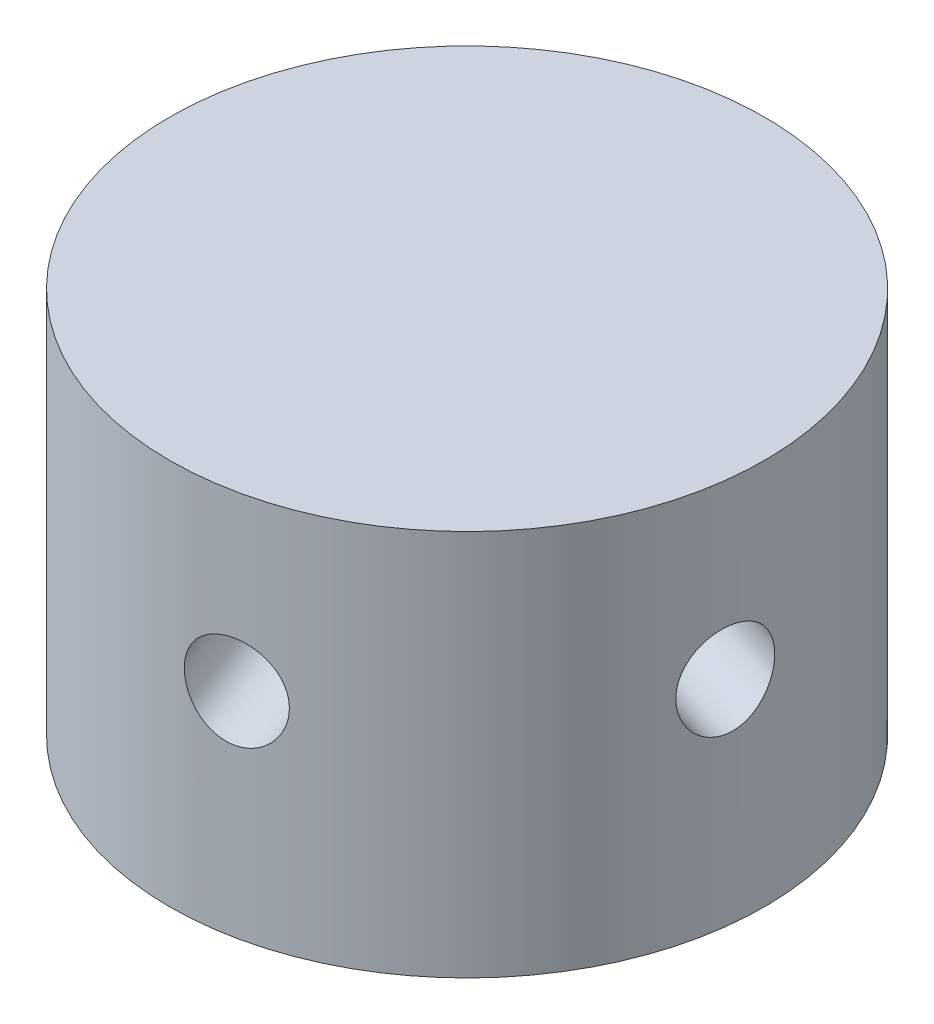
from build123d import *

# Parameters (mm, degrees)
BOSS_EXTRUDE1_DEPTH      = 3
BOSS_EXTRUDE1_DEPTH_BACK = 10
SKETCH1_R                = 10
SKETCH4_R                = 1.5
HOLE_DEPTH               = 20.973741561
HOLECIR_COUNT            = 5
SKETCH6_R                = 3.5
BEARINGHOLE_DEPTH        = 2.5
SKETCH7_R                = 2
SHAFTHOLE_DEPTH          = 17.248076982
SKETCH8_W                = 1.346153846
SKETCH8_H                = 0.358974359
SKETCH8_W_2              = 0.314102564
SKETCH8_H_2              = 2.557692308
BOSS_EXTRUDE3_DEPTH      = 1


with BuildPart() as part:
    # Sketch1 → Boss-Extrude1 (new, two sides: drawn at the far end of the back side and taken through both)
    with BuildSketch(Plane(origin=(0, 0, 0), x_dir=(1, 0, 0), z_dir=(0, 1, 0)).offset(-BOSS_EXTRUDE1_DEPTH_BACK)):
        Circle(SKETCH1_R)
    extrude(amount=BOSS_EXTRUDE1_DEPTH + BOSS_EXTRUDE1_DEPTH_BACK)

    # Sketch4 → hole (cut, through all)
    with BuildSketch(Plane(origin=(-3.352872105, -1.093066116, 1.887711608), x_dir=(-0.4486862613641547, -0.14627571033740308, -0.8816371449912632), z_dir=(0.8382180262940947, 0.2732665289126682, -0.47192790187872385))):
        Circle(SKETCH4_R)
    hole = extrude(amount=-HOLE_DEPTH, mode=Mode.SUBTRACT)

    # holecir: hole ×5 about axis
    holecir_axis = Axis((0, 5.5, 0), (0, -1, 0))
    for i in range(1, HOLECIR_COUNT):
        add(hole.rotate(holecir_axis, i * 360 / HOLECIR_COUNT), mode=Mode.SUBTRACT)

    # Sketch6 → bearinghole (cut)
    with BuildSketch(Plane(origin=(0, -5, 0), x_dir=(-1, 0, 0), z_dir=(0, -1, 0))):
        Circle(SKETCH6_R)
    extrude(amount=BEARINGHOLE_DEPTH, mode=Mode.SUBTRACT)

    # Sketch7 → shafthole (cut, through all)
    with BuildSketch(Plane(origin=(0, -5, 0), x_dir=(-1, 0, 0), z_dir=(0, -1, 0))):
        Circle(SKETCH7_R)
    extrude(amount=SHAFTHOLE_DEPTH, mode=Mode.SUBTRACT)

    # Sketch8 → Boss-Extrude3 (add)
    # profile 1 of 7: a face of its own
    with BuildSketch(Plane.XZ.offset(10)):
        with BuildLine():
            Line((-4.105769231, 6.129779464), (-4.105769231, 5.770805105))
            Line((-4.105769231, 5.770805105), (-5.296274038, 5.770805105))
            Line((-5.296274038, 5.770805105), (-5.484875801, 4.850232189))
            add(Edge.make_bspline(
                [(-5.484875801, 4.850232189), (-5.447819927, 4.860462461), (-5.376030031, 4.880281994), (-5.27007017, 4.902287765), (-5.169477967, 4.915553209), (-5.104202596, 4.917364519), (-5.072616186, 4.918241003)],
                knots=[0, 0, 0, 0, 1.100273476, 2.13160584, 3.095893838, 4, 4, 4, 4], degree=3))
            add(Edge.make_bspline(
                [(-5.072616186, 4.918241003), (-5.033532446, 4.917395067), (-4.956684049, 4.915731746), (-4.844245102, 4.899759897), (-4.736912209, 4.874619982), (-4.634909838, 4.83949946), (-4.538049288, 4.794589727), (-4.447221726, 4.738489787), (-4.361063813, 4.672956456), (-4.281121219, 4.597611444), (-4.208596911, 4.514689827), (-4.144830922, 4.425531956), (-4.090668331, 4.331004294), (-4.047107576, 4.230203685), (-4.012323242, 4.124244532), (-3.989171247, 4.012011949), (-3.973754538, 3.894563829), (-3.972032152, 3.814259259), (-3.971153846, 3.773309112)],
                knots=[0, 0, 0, 0, 1.052922333, 2.070308379, 3.05430497, 4.020497103, 4.973039431, 5.925935799, 6.892292201, 7.88610001, 8.88166317, 9.857072816, 10.836096531, 11.812156883, 12.81219415, 13.836441305, 14.89672472, 16, 16, 16, 16], degree=3))
            add(Edge.make_bspline(
                [(-3.971153846, 3.773309112), (-3.971818921, 3.744786892), (-3.973140084, 3.688127904), (-3.979858672, 3.603983703), (-3.992794388, 3.52162087), (-4.010162112, 3.441028478), (-4.03270453, 3.362359106), (-4.059993584, 3.285387578), (-4.093389611, 3.210592971), (-4.130020987, 3.137267576), (-4.171267465, 3.067069069), (-4.217045972, 3.001420083), (-4.265411463, 2.939335801), (-4.317452849, 2.881482068), (-4.373653844, 2.82823905), (-4.433333811, 2.779290769), (-4.49601653, 2.733809439), (-4.562671772, 2.693641243), (-4.631814255, 2.656678287), (-4.704442472, 2.62635475), (-4.778903172, 2.599244222), (-4.856268048, 2.577634694), (-4.936361861, 2.56070214), (-5.019316636, 2.549201539), (-5.104697306, 2.540825102), (-5.162572319, 2.540300745), (-5.191806891, 2.540035875)],
                knots=[0, 0, 0, 0, 1.056347294, 2.098418968, 3.122841568, 4.141288669, 5.149314143, 6.15115421, 7.162517403, 8.180376062, 9.185164535, 10.17417709, 11.141909838, 12.097768115, 13.052685741, 14.0056014, 14.954263652, 15.917497458, 16.885230207, 17.854509472, 18.828990115, 19.81800267, 20.826176721, 21.857883937, 22.917946725, 24, 24, 24, 24], degree=3))
            add(Edge.make_bspline(
                [(-5.191806891, 2.540035875), (-5.226681072, 2.540726713), (-5.295291902, 2.542085855), (-5.39581247, 2.55630434), (-5.492527075, 2.576668256), (-5.584657176, 2.607304526), (-5.67302844, 2.645691821), (-5.756451158, 2.694207992), (-5.837056934, 2.749187096), (-5.911568971, 2.814067449), (-5.980725084, 2.884983131), (-6.042631593, 2.961940772), (-6.09776517, 3.043670214), (-6.145242917, 3.130568369), (-6.185740938, 3.222406899), (-6.217555926, 3.3195299), (-6.243234281, 3.421429904), (-6.254097702, 3.491583415), (-6.259615385, 3.527215362)],
                knots=[0, 0, 0, 0, 1.0467383, 2.05933395, 3.04377827, 4.011590433, 4.970194871, 5.932262533, 6.905835911, 7.896367577, 8.894135286, 9.877477877, 10.858688626, 11.851381753, 12.8477658, 13.868841284, 14.917554742, 16, 16, 16, 16], degree=3))
            Line((-6.259615385, 3.527215362), (-5.945512821, 3.527215362))
            add(Edge.make_bspline(
                [(-5.945512821, 3.527215362), (-5.937784263, 3.493838909), (-5.922929547, 3.429687515), (-5.890323798, 3.339556173), (-5.850457922, 3.25923695), (-5.803053574, 3.187667366), (-5.746503544, 3.125258369), (-5.681974115, 3.069641307), (-5.609626391, 3.019466178), (-5.529233162, 2.977643411), (-5.444420083, 2.941974657), (-5.355652873, 2.918222962), (-5.265348526, 2.901522069), (-5.204270156, 2.899850309), (-5.173577724, 2.899010234)],
                knots=[0, 0, 0, 0, 1.136247022, 2.183929868, 3.172523383, 4.106158343, 5.02341133, 5.958108904, 6.928429099, 7.938127109, 8.96079061, 9.975095812, 10.982467395, 12, 12, 12, 12], degree=3))
            add(Edge.make_bspline(
                [(-5.173577724, 2.899010234), (-5.14361928, 2.899831012), (-5.084630858, 2.90144713), (-4.997819471, 2.913886142), (-4.914006597, 2.933043713), (-4.83401924, 2.961713568), (-4.756457701, 2.996558287), (-4.68328393, 3.041273363), (-4.612381053, 3.092733381), (-4.545952919, 3.151690011), (-4.48511347, 3.216659706), (-4.431357349, 3.286137099), (-4.386580436, 3.360253946), (-4.348846327, 3.437727099), (-4.320193028, 3.519405656), (-4.299752047, 3.604906831), (-4.287748988, 3.694441811), (-4.286097808, 3.755511121), (-4.28525641, 3.786630426)],
                knots=[0, 0, 0, 0, 1.027316725, 2.022795036, 3.002884548, 3.971462791, 4.93288096, 5.914575861, 6.907176829, 7.935150275, 8.956128384, 9.956726525, 10.942570165, 11.921478529, 12.907843606, 13.90538589, 14.932640048, 16, 16, 16, 16], degree=3))
            add(Edge.make_bspline(
                [(-4.28525641, 3.786630426), (-4.28591489, 3.814706178), (-4.28720377, 3.869660467), (-4.29773434, 3.950059673), (-4.316051312, 4.026132715), (-4.341475192, 4.098246949), (-4.3737547, 4.166470392), (-4.413201012, 4.230873452), (-4.46055441, 4.290607285), (-4.514646299, 4.345699839), (-4.57390434, 4.396544714), (-4.639348082, 4.4398888), (-4.709608009, 4.476352718), (-4.783837609, 4.507820716), (-4.863802507, 4.530421461), (-4.94791914, 4.547389347), (-5.037095847, 4.55720471), (-5.098066536, 4.558566598), (-5.129407051, 4.559266644)],
                knots=[0, 0, 0, 0, 1.045622112, 2.046656509, 3.013763289, 3.955457236, 4.890082067, 5.820317437, 6.762574623, 7.722996705, 8.69280354, 9.665887285, 10.63943826, 11.638615906, 12.663482002, 13.728887084, 14.832589034, 16, 16, 16, 16], degree=3))
            add(Edge.make_bspline(
                [(-5.129407051, 4.559266644), (-5.15653598, 4.558686053), (-5.212550335, 4.557487279), (-5.298473162, 4.548660782), (-5.388764885, 4.534421488), (-5.483079381, 4.514835241), (-5.581699889, 4.489204164), (-5.68441829, 4.458489663), (-5.791450556, 4.421767664), (-5.863568281, 4.394035451), (-5.900641026, 4.379779464)],
                knots=[0, 0, 0, 0, 0.817624296, 1.688186739, 2.600797293, 3.572016777, 4.590301741, 5.671205678, 6.80286297, 8, 8, 8, 8], degree=3))
            Line((-5.900641026, 4.379779464), (-5.541666667, 6.129779464))
            Line((-5.541666667, 6.129779464), (-4.105769231, 6.129779464))
        make_face()
    # profile 2 of 7: a face of its own
    with BuildSketch(Plane.XZ.offset(10)):
        with Locations((-2.939102564, 3.975933311)):
            Rectangle(SKETCH8_W, SKETCH8_H)
    # profile 3 of 7: a face of its own
    with BuildSketch(Plane.XZ.offset(10)):
        with BuildLine():
            Line((0.830128205, 5.187471772), (0.830128205, 2.629779464))
            Line((0.830128205, 2.629779464), (0.516025641, 2.629779464))
            Line((0.516025641, 2.629779464), (0.516025641, 3.072187317))
            add(Edge.make_bspline(
                [(0.516025641, 3.072187317), (0.48060685, 3.032147723), (0.411486635, 2.954009952), (0.296045517, 2.851927779), (0.173677339, 2.767549458), (0.044976018, 2.699399542), (-0.089942225, 2.648207486), (-0.230778313, 2.611821327), (-0.377589693, 2.588427492), (-0.477842048, 2.58609147), (-0.528645833, 2.58490767)],
                knots=[0, 0, 0, 0, 1.074387032, 2.096679803, 3.090159297, 4.057316773, 5.018401886, 5.985159533, 6.978961417, 8, 8, 8, 8], degree=3))
            add(Edge.make_bspline(
                [(-0.528645833, 2.58490767), (-0.573813787, 2.586134042), (-0.662886992, 2.588552502), (-0.793916069, 2.607314806), (-0.920008319, 2.637445427), (-1.041282891, 2.679346317), (-1.156955037, 2.734927139), (-1.268015133, 2.801468387), (-1.373887825, 2.880709217), (-1.472959364, 2.971297245), (-1.564191365, 3.069692232), (-1.644252637, 3.174637779), (-1.711005717, 3.285680083), (-1.766825798, 3.401413237), (-1.809822142, 3.522728156), (-1.839795777, 3.649205324), (-1.858536223, 3.780695198), (-1.860953684, 3.870234721), (-1.862179487, 3.915636836)],
                knots=[0, 0, 0, 0, 1.033919861, 2.038935746, 3.024066025, 3.998881131, 4.97069526, 5.957263378, 6.95902576, 7.993208707, 9.027059324, 10.027763471, 11.009749337, 11.988697705, 12.965288445, 13.950418724, 14.960734635, 16, 16, 16, 16], degree=3))
            add(Edge.make_bspline(
                [(-1.862179487, 3.915636836), (-1.860926516, 3.96010054), (-1.858449459, 4.048002883), (-1.839996239, 4.177281581), (-1.80896523, 4.301799842), (-1.765417383, 4.421156785), (-1.709575428, 4.535496835), (-1.641647341, 4.64490086), (-1.561628216, 4.749670258), (-1.469375809, 4.847341484), (-1.369441039, 4.937562099), (-1.262532308, 5.015971144), (-1.151309027, 5.083687993), (-1.034046016, 5.137341469), (-0.912478911, 5.180750574), (-0.785525466, 5.210783542), (-0.653713887, 5.228480863), (-0.564223395, 5.231043627), (-0.518830128, 5.232343567)],
                knots=[0, 0, 0, 0, 1.020392517, 2.01726096, 2.990465484, 3.961182959, 4.928053699, 5.906110375, 6.912531644, 7.948652711, 8.985773172, 9.998621852, 10.987621588, 11.969261332, 12.953316658, 13.946091881, 14.958173133, 16, 16, 16, 16], degree=3))
            add(Edge.make_bspline(
                [(-0.518830128, 5.232343567), (-0.466630269, 5.230905815), (-0.364268809, 5.228086453), (-0.2145408, 5.204623725), (-0.072896322, 5.164985258), (0.06175803, 5.11106776), (0.188938716, 5.039419031), (0.3074417, 4.94903907), (0.418507184, 4.840497883), (0.482887475, 4.757127438), (0.516025641, 4.714214561)],
                knots=[0, 0, 0, 0, 1.038897134, 2.037228247, 3.008116434, 3.962042015, 4.918381754, 5.904844433, 6.921570401, 8, 8, 8, 8], degree=3))
            Line((0.516025641, 4.714214561), (0.516025641, 5.187471772))
            Line((0.516025641, 5.187471772), (0.830128205, 5.187471772))
        make_face()
        with BuildLine():
            add(Edge.make_bspline(
                [(-0.514623397, 4.918241003), (-0.560537735, 4.916607365), (-0.651165335, 4.913382824), (-0.784209337, 4.888209329), (-0.911522751, 4.846324735), (-1.032468826, 4.789042833), (-1.145137042, 4.717014097), (-1.245830713, 4.629892713), (-1.335373415, 4.530055699), (-1.410681679, 4.417953589), (-1.472072176, 4.297775498), (-1.515239208, 4.17215106), (-1.543708455, 4.043346082), (-1.546616976, 3.955983396), (-1.548076923, 3.912131227)],
                knots=[0, 0, 0, 0, 1.031046209, 2.035121221, 3.029706178, 4.034933723, 5.034054252, 6.02443088, 7.017295772, 8.038157696, 9.050218397, 10.03989886, 11.016116709, 12, 12, 12, 12], degree=3))
            add(Edge.make_bspline(
                [(-1.548076923, 3.912131227), (-1.54621203, 3.86854112), (-1.542489553, 3.781531764), (-1.515738859, 3.652551187), (-1.470858985, 3.526897145), (-1.409616922, 3.405636152), (-1.332930298, 3.293052051), (-1.244041645, 3.191311929), (-1.142091364, 3.103822341), (-1.029163857, 3.030584767), (-0.908555886, 2.971422246), (-0.781721955, 2.930256607), (-0.651046317, 2.903678826), (-0.562193983, 2.900574349), (-0.517427885, 2.899010234)],
                knots=[0, 0, 0, 0, 0.979072187, 1.954306742, 2.945804271, 3.96968567, 4.997920485, 5.998718438, 6.996577872, 8.005894225, 9.015743152, 10.005417472, 10.995077863, 12, 12, 12, 12], degree=3))
            add(Edge.make_bspline(
                [(-0.517427885, 2.899010234), (-0.471981382, 2.900670198), (-0.381592795, 2.903971701), (-0.248154087, 2.929252966), (-0.118659125, 2.971021765), (0.005128104, 3.028920892), (0.120444235, 3.100678247), (0.223942112, 3.184685338), (0.311458081, 3.282388523), (0.38565069, 3.389764976), (0.443826107, 3.507476972), (0.486202166, 3.632811163), (0.511256072, 3.765771911), (0.514413802, 3.856635838), (0.516025641, 3.903016644)],
                knots=[0, 0, 0, 0, 1.01762866, 2.023962475, 3.030623092, 4.058876274, 5.077231937, 6.066672613, 7.034107872, 8.005628644, 8.981990164, 9.965428785, 10.961468474, 12, 12, 12, 12], degree=3))
            add(Edge.make_bspline(
                [(0.516025641, 3.903016644), (0.515065985, 3.938354474), (0.513177077, 4.007910508), (0.498746508, 4.110038025), (0.475791581, 4.207771751), (0.443445411, 4.30121444), (0.400954127, 4.389849456), (0.349706361, 4.474313216), (0.288800911, 4.554166427), (0.219218215, 4.628309498), (0.143053013, 4.695935961), (0.062458472, 4.756300201), (-0.023520275, 4.805888974), (-0.113437312, 4.846930246), (-0.207448646, 4.879589396), (-0.306319266, 4.901377089), (-0.408998253, 4.91633741), (-0.479044309, 4.917599791), (-0.514623397, 4.918241003)],
                knots=[0, 0, 0, 0, 1.050140795, 2.067009409, 3.05949893, 4.030605086, 5.00011959, 5.97591094, 6.962425594, 7.979863591, 8.993523472, 9.986985069, 10.967611495, 11.937549037, 12.921786183, 13.919465291, 14.943216303, 16, 16, 16, 16], degree=3))
        make_face(mode=Mode.SUBTRACT)
    # profile 4 of 7: a face of its own
    with BuildSketch(Plane.XZ.offset(10)):
        Polygon((1.323717949, 5.187471772), (1.697415865, 5.187471772), (2.355769231, 4.26479549), (3.014122596, 5.187471772), (3.387820513, 5.187471772), (2.54296875, 4.003277061), (3.522435897, 2.629779464), (3.148737981, 2.629779464), (2.355769231, 3.741057509), (1.562800481, 2.629779464), (1.189102564, 2.629779464), (2.169270833, 4.003277061), align=None)
    # profile 5 of 7: a face of its own
    with BuildSketch(Plane.XZ.offset(10)):
        with BuildLine():
            add(Edge.make_bspline(
                [(3.9921875, 6.264394849), (4.011678816, 6.263490697), (4.049846556, 6.261720193), (4.105039823, 6.246558716), (4.155296835, 6.22085903), (4.199874568, 6.186379349), (4.238126455, 6.145829906), (4.264907165, 6.098568937), (4.282119561, 6.047510299), (4.284198117, 6.011895209), (4.28525641, 5.993761836)],
                knots=[0, 0, 0, 0, 1.055194115, 2.066272739, 3.074728998, 4.095836921, 5.109056067, 6.073838105, 7.019297344, 8, 8, 8, 8], degree=3))
            add(Edge.make_bspline(
                [(4.28525641, 5.993761836), (4.28417425, 5.976099183), (4.282034949, 5.941182208), (4.26492046, 5.891008736), (4.237898222, 5.844404453), (4.199899097, 5.803933742), (4.155290336, 5.769473122), (4.10504155, 5.743768383), (4.049846101, 5.728608246), (4.011678662, 5.726837557), (3.9921875, 5.725933311)],
                knots=[0, 0, 0, 0, 0.96129708, 1.900370562, 2.859976407, 3.87933698, 4.906634145, 5.921202961, 6.938410037, 8, 8, 8, 8], degree=3))
            add(Edge.make_bspline(
                [(3.9921875, 5.725933311), (3.972919225, 5.726803031), (3.935416045, 5.728495828), (3.881049202, 5.744065845), (3.831220713, 5.769481918), (3.78655604, 5.803708104), (3.749325847, 5.844653001), (3.722227522, 5.890980295), (3.70515256, 5.941189449), (3.703007931, 5.976101616), (3.701923077, 5.993761836)],
                knots=[0, 0, 0, 0, 1.054934014, 2.053291228, 3.073705704, 4.106921865, 5.123545215, 6.088680038, 7.033164197, 8, 8, 8, 8], degree=3))
            add(Edge.make_bspline(
                [(3.701923077, 5.993761836), (3.702984164, 6.011892686), (3.705068205, 6.047502818), (3.722240321, 6.098597851), (3.749100129, 6.145579353), (3.786580692, 6.186604853), (3.831214152, 6.220850287), (3.881050897, 6.246261269), (3.935415597, 6.261832608), (3.972919073, 6.263525223), (3.9921875, 6.264394849)],
                knots=[0, 0, 0, 0, 0.98631895, 1.937192651, 2.907499808, 3.917963147, 4.944918757, 5.95915025, 6.951458133, 8, 8, 8, 8], degree=3))
        make_face()
    # profile 6 of 7: a face of its own
    with BuildSketch(Plane.XZ.offset(10)):
        with Locations((3.993589744, 3.908625618)):
            Rectangle(SKETCH8_W_2, SKETCH8_H_2)
    # profile 7 of 7: a face of its own
    with BuildSketch(Plane.XZ.offset(10)):
        with BuildLine():
            Line((6.125, 4.868461355), (5.911858974, 4.649010234))
            add(Edge.make_bspline(
                [(5.911858974, 4.649010234), (5.893468471, 4.67032338), (5.858013745, 4.711412617), (5.801782264, 4.766349684), (5.74575866, 4.812486622), (5.690709847, 4.851438881), (5.635251578, 4.880888028), (5.58003466, 4.90238289), (5.525001921, 4.915684696), (5.488215886, 4.917399134), (5.470152244, 4.918241003)],
                knots=[0, 0, 0, 0, 1.26578478, 2.440284043, 3.530471711, 4.527705817, 5.468200915, 6.346673037, 7.188140097, 8, 8, 8, 8], degree=3))
            add(Edge.make_bspline(
                [(5.470152244, 4.918241003), (5.448012854, 4.91716613), (5.404445668, 4.915050932), (5.342019849, 4.893937502), (5.284069224, 4.861528763), (5.233912244, 4.81556018), (5.191424564, 4.762795911), (5.160410883, 4.703799586), (5.1414449, 4.640351542), (5.139040168, 4.596321685), (5.137820513, 4.573990202)],
                knots=[0, 0, 0, 0, 0.99966794, 1.967205029, 2.953328237, 3.988086729, 5.028030931, 6.008226631, 6.989793394, 8, 8, 8, 8], degree=3))
            add(Edge.make_bspline(
                [(5.137820513, 4.573990202), (5.138931325, 4.553778157), (5.141149818, 4.513411047), (5.158396497, 4.453863013), (5.18586257, 4.395805975), (5.211532764, 4.360243068), (5.224759615, 4.341918887)],
                knots=[0, 0, 0, 0, 0.960159726, 1.917612774, 2.927026955, 4, 4, 4, 4], degree=3))
            add(Edge.make_bspline(
                [(5.224759615, 4.341918887), (5.232723109, 4.332134303), (5.249672402, 4.311309049), (5.281480917, 4.282405195), (5.31750342, 4.250462944), (5.360823358, 4.218526107), (5.409574385, 4.184894382), (5.46481367, 4.150892249), (5.524788175, 4.113927824), (5.567725481, 4.090483389), (5.590044071, 4.078297093)],
                knots=[0, 0, 0, 0, 0.66740084, 1.420478572, 2.27185888, 3.217733974, 4.268547843, 5.408967954, 6.65319498, 8, 8, 8, 8], degree=3))
            add(Edge.make_bspline(
                [(5.590044071, 4.078297093), (5.617257648, 4.06305219), (5.669825318, 4.033604057), (5.744518085, 3.987894354), (5.812305126, 3.94246293), (5.873760794, 3.897795656), (5.927702602, 3.852642788), (5.975767155, 3.808735031), (6.016755599, 3.764745723), (6.039709526, 3.734012609), (6.05068109, 3.719322734)],
                knots=[0, 0, 0, 0, 1.27191281, 2.456916733, 3.569705269, 4.599008579, 5.553216877, 6.436649441, 7.252746552, 8, 8, 8, 8], degree=3))
            add(Edge.make_bspline(
                [(6.05068109, 3.719322734), (6.068891617, 3.689656646), (6.105133946, 3.630615624), (6.143192213, 3.533397197), (6.165252488, 3.430286695), (6.168314708, 3.359754474), (6.169871795, 3.323890041)],
                knots=[0, 0, 0, 0, 0.995354457, 1.980940102, 2.973342416, 4, 4, 4, 4], degree=3))
            add(Edge.make_bspline(
                [(6.169871795, 3.323890041), (6.169152261, 3.298620895), (6.167734341, 3.248825282), (6.157876274, 3.175490452), (6.140921298, 3.105355895), (6.117827544, 3.03766061), (6.086643171, 2.97370167), (6.050095374, 2.911865421), (6.006220462, 2.853489491), (5.956129086, 2.79865053), (5.901283592, 2.748564783), (5.842777454, 2.704540829), (5.780538624, 2.667966492), (5.715011822, 2.637701147), (5.646048168, 2.613632889), (5.573636879, 2.596970358), (5.498008124, 2.586997596), (5.446578316, 2.58561312), (5.420372596, 2.58490767)],
                knots=[0, 0, 0, 0, 1.032770009, 2.035186124, 3.017557409, 3.978232242, 4.952395191, 5.920591857, 6.910227898, 7.931268572, 8.952309245, 9.941945286, 10.918353717, 11.897095711, 12.887975737, 13.898235213, 14.929059601, 16, 16, 16, 16], degree=3))
            add(Edge.make_bspline(
                [(5.420372596, 2.58490767), (5.385005421, 2.58590037), (5.314762494, 2.587871977), (5.210872775, 2.606378038), (5.109352016, 2.635173432), (5.010968476, 2.674889366), (4.917922362, 2.725040079), (4.832791437, 2.785102473), (4.755279975, 2.85309247), (4.711161701, 2.905205381), (4.689102564, 2.931261836)],
                knots=[0, 0, 0, 0, 1.013940152, 2.01379169, 3.017749504, 4.037548394, 5.051665909, 6.043208538, 7.021604269, 8, 8, 8, 8], degree=3))
            Line((4.689102564, 2.931261836), (4.897335737, 3.168241003))
            add(Edge.make_bspline(
                [(4.897335737, 3.168241003), (4.91710815, 3.146886238), (4.955439962, 3.105486798), (5.016741179, 3.050362458), (5.07912058, 3.004161187), (5.141955267, 2.965517772), (5.206175361, 2.935742369), (5.271420975, 2.914823775), (5.337559399, 2.901379583), (5.381981535, 2.8998013), (5.404246795, 2.899010234)],
                knots=[0, 0, 0, 0, 1.179806542, 2.287233372, 3.337373186, 4.324005949, 5.273901747, 6.200048787, 7.097828587, 8, 8, 8, 8], degree=3))
            add(Edge.make_bspline(
                [(5.404246795, 2.899010234), (5.434564721, 2.900381059), (5.493800862, 2.90305942), (5.578644621, 2.927376512), (5.656983247, 2.965506464), (5.725006593, 3.019591162), (5.782908754, 3.082546735), (5.824836928, 3.153460854), (5.851113104, 3.230252311), (5.854199103, 3.283484614), (5.855769231, 3.310568727)],
                knots=[0, 0, 0, 0, 1.072336372, 2.095165389, 3.102688358, 4.141489647, 5.156069229, 6.117746104, 7.042326257, 8, 8, 8, 8], degree=3))
            add(Edge.make_bspline(
                [(5.855769231, 3.310568727), (5.854682936, 3.332878346), (5.852538194, 3.376925702), (5.835694922, 3.440676043), (5.809082069, 3.501145323), (5.782877421, 3.536534971), (5.76953125, 3.554559112)],
                knots=[0, 0, 0, 0, 1.013901739, 2.00181326, 2.98231254, 4, 4, 4, 4], degree=3))
            add(Edge.make_bspline(
                [(5.76953125, 3.554559112), (5.761508856, 3.563594474), (5.744033183, 3.583276756), (5.711977942, 3.611701835), (5.67359608, 3.642339934), (5.628455917, 3.674671523), (5.576466455, 3.708270128), (5.517416979, 3.742959481), (5.452116427, 3.780387206), (5.405945796, 3.805206862), (5.381810897, 3.818180907)],
                knots=[0, 0, 0, 0, 0.615000592, 1.339693406, 2.178160186, 3.116406724, 4.166410947, 5.330106347, 6.604359322, 8, 8, 8, 8], degree=3))
            add(Edge.make_bspline(
                [(5.381810897, 3.818180907), (5.355764257, 3.832720038), (5.30525151, 3.860916055), (5.233704219, 3.904832135), (5.169156865, 3.94949941), (5.11005629, 3.992412249), (5.057895285, 4.035833193), (5.012879336, 4.079810444), (4.97323612, 4.12257043), (4.951288709, 4.152867727), (4.940805288, 4.167339561)],
                knots=[0, 0, 0, 0, 1.262093308, 2.447601706, 3.550203992, 4.582594899, 5.537233252, 6.418365656, 7.244515135, 8, 8, 8, 8], degree=3))
            add(Edge.make_bspline(
                [(4.940805288, 4.167339561), (4.922674689, 4.196485176), (4.886407154, 4.254786591), (4.851191962, 4.352097068), (4.826985934, 4.454542125), (4.824823543, 4.525228979), (4.823717949, 4.561370009)],
                knots=[0, 0, 0, 0, 0.985009483, 1.970363186, 2.962279964, 4, 4, 4, 4], degree=3))
            add(Edge.make_bspline(
                [(4.823717949, 4.561370009), (4.824252144, 4.584995407), (4.82529764, 4.631233658), (4.833641692, 4.699172479), (4.848833403, 4.763720632), (4.867888325, 4.825847495), (4.89437133, 4.884349589), (4.926017235, 4.94000706), (4.96320466, 4.992742978), (5.006047951, 5.041746111), (5.053154596, 5.086255437), (5.104049366, 5.125054065), (5.157587622, 5.15816042), (5.213996042, 5.18592558), (5.273816515, 5.206926963), (5.336630901, 5.221384348), (5.402312056, 5.231039551), (5.447213182, 5.231902635), (5.470152244, 5.232343567)],
                knots=[0, 0, 0, 0, 1.087655834, 2.128696564, 3.144119009, 4.137814668, 5.115653402, 6.093965665, 7.082169637, 8.081268856, 9.086088321, 10.061021666, 11.022561449, 11.980240094, 12.950172527, 13.934149372, 14.944599409, 16, 16, 16, 16], degree=3))
            add(Edge.make_bspline(
                [(5.470152244, 5.232343567), (5.497344307, 5.231239226), (5.552238529, 5.229009829), (5.634593155, 5.211304138), (5.716826497, 5.182171034), (5.799149847, 5.141934801), (5.880960136, 5.089867925), (5.962976993, 5.026938625), (6.046185023, 4.953560911), (6.098141336, 4.897461685), (6.125, 4.868461355)],
                knots=[0, 0, 0, 0, 0.845714091, 1.707292901, 2.609013841, 3.555613372, 4.552488639, 5.621697636, 6.770543573, 8, 8, 8, 8], degree=3))
        make_face()
    extrude(amount=BOSS_EXTRUDE3_DEPTH)


solid = part.part
